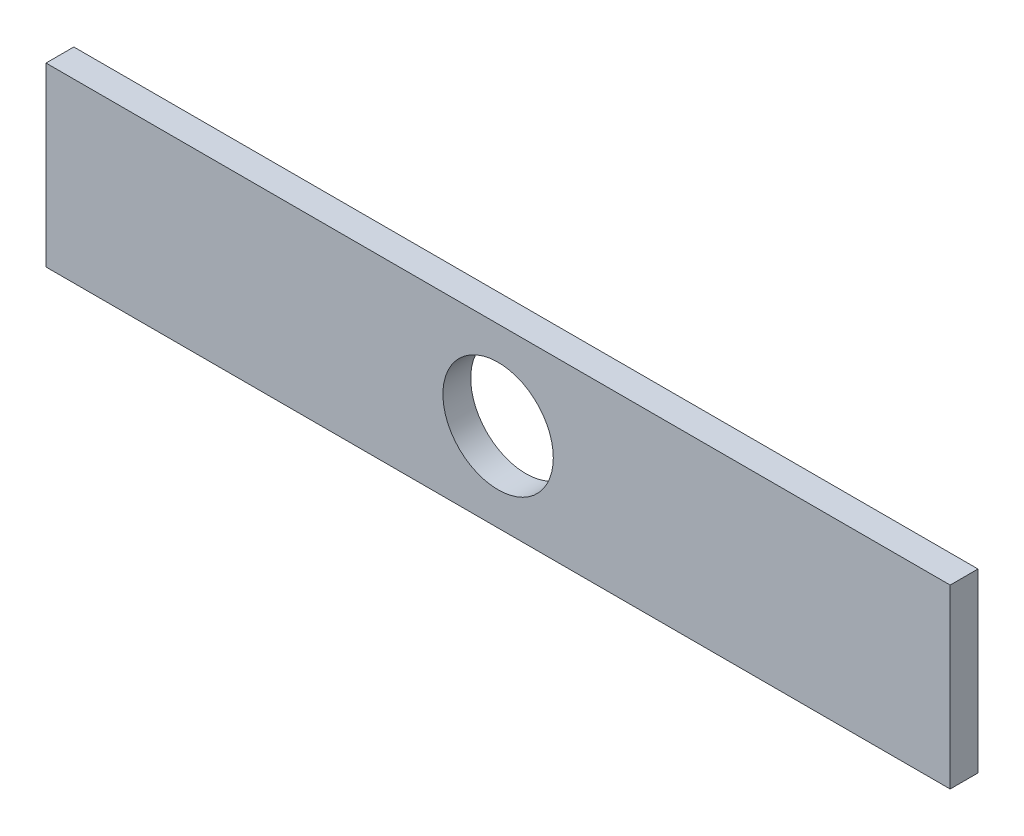
from build123d import *

# Parameters (mm, degrees)
CROQUIS1_W              = 130
CROQUIS1_H              = 25.4
CROQUIS1_R              = 7.9375
SALIENTE_EXTRUIR1_DEPTH = 4


with BuildPart() as part:
    # Croquis1 → Saliente-Extruir1 (new body)
    with BuildSketch(Plane.XY):
        Rectangle(CROQUIS1_W, CROQUIS1_H)
        Circle(CROQUIS1_R, mode=Mode.SUBTRACT)
    extrude(amount=SALIENTE_EXTRUIR1_DEPTH)


solid = part.part
